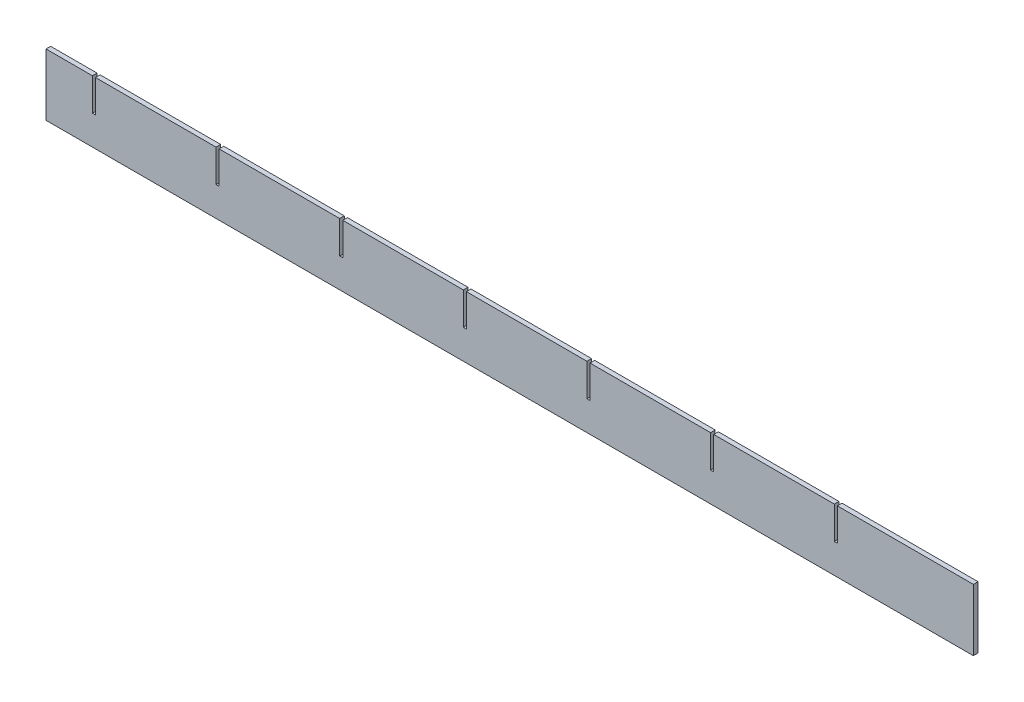
from build123d import *

# Parameters (mm, degrees)
BOSS_EXTRUDE1_DEPTH = 3


with BuildPart() as part:
    # Sketch1 → Boss-Extrude1 (new body)
    with BuildSketch(Plane.XY):
        Polygon((-268, 20), (-190, 20), (-190, -1), (-188, -1), (-188, 20), (-110, 20), (-110, -1), (-108, -1), (-108, 20), (-30, 20), (-30, -1), (-28, -1), (-28, 20), (50, 20), (50, -1), (52, -1), (52, 20), (130, 20), (130, -1), (132, -1), (132, 20), (210, 20), (210, -1), (212, -1), (212, 20), (300, 20), (300, -20), (-300, -20), (-300, 20), (-270, 20), (-270, -1), (-268, -1), align=None)
    extrude(amount=BOSS_EXTRUDE1_DEPTH)


solid = part.part
